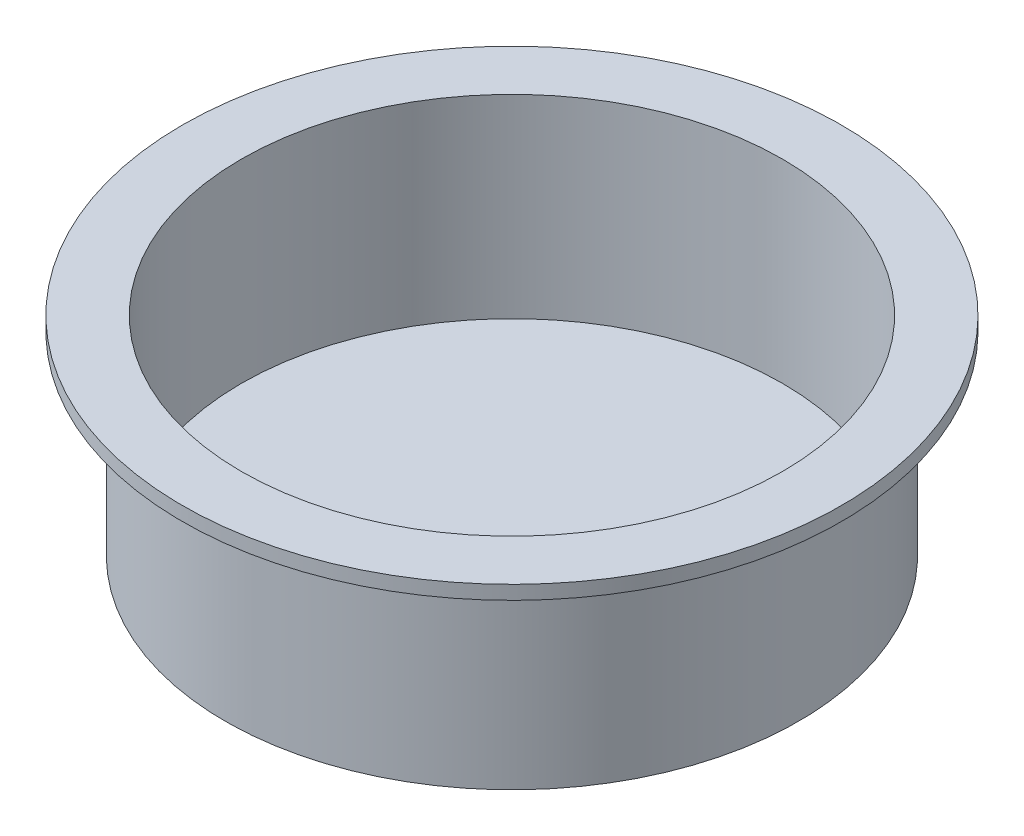
from build123d import *

# Parameters (mm, degrees)
SKETCH4_R          = 24.765
CUT_EXTRUDE1_DEPTH = 17.78


with BuildPart() as part:
    # Sketch3 → Revolve1 (revolve)
    with BuildSketch(Plane.XY, mode=Mode.PRIVATE) as revolve1_sk:
        Polygon((0, 0), (26.2509, 0), (26.2509, 17.78), (30.1625, 17.78), (30.1625, 19.05), (0, 19.05), align=None)
    revolve(revolve1_sk.sketch.rotate(Axis((0, 19.05, 0), (0, -1, 0)), 180), axis=Axis((0, 19.05, 0), (0, -1, 0)))

    # Sketch4 → Cut-Extrude1 (cut)
    with BuildSketch(Plane(origin=(0, 19.05, 0), x_dir=(1, 0, 0), z_dir=(0, 1, 0))):
        with Locations(Location((0, 0, 0), (0, 0, 180))):
            Circle(SKETCH4_R)
    extrude(amount=-CUT_EXTRUDE1_DEPTH, mode=Mode.SUBTRACT)


solid = part.part
